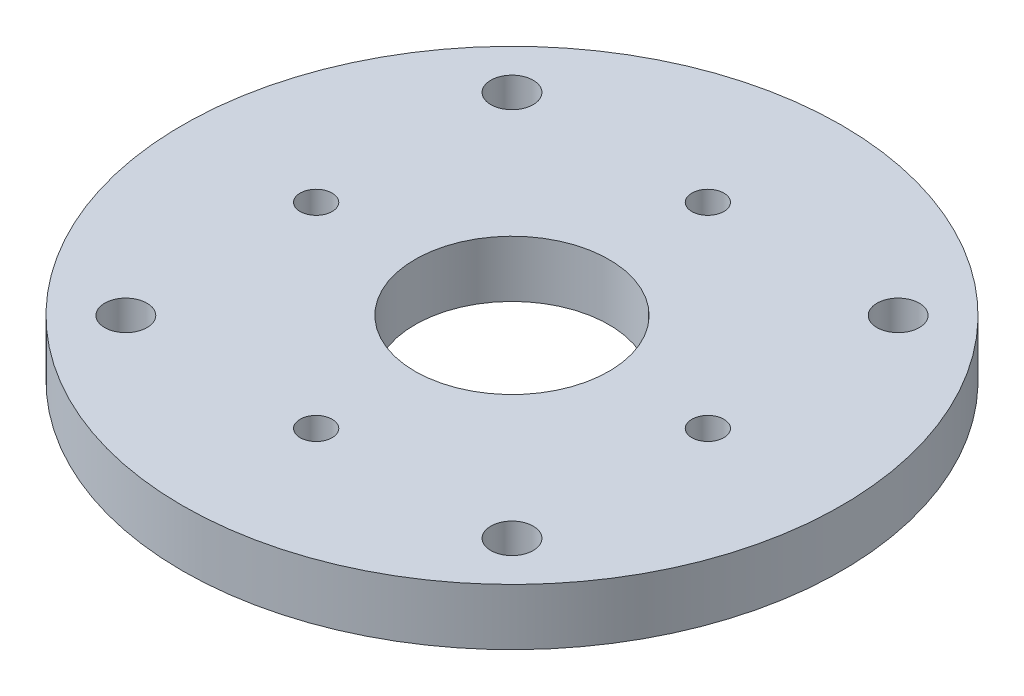
from build123d import *

# Parameters (mm, degrees)
SKETCH1_R           = 35
SKETCH1_R_2         = 10.3
BOSS_EXTRUDE1_DEPTH = 6
SKETCH3_R           = 1.7
CUT_EXTRUDE1_DEPTH  = 50.859803449
SKETCH5_R           = 2.25
CUT_EXTRUDE2_DEPTH  = 50.859803449


with BuildPart() as part:
    # Sketch1 → Boss-Extrude1 (new body)
    with BuildSketch(Plane(origin=(0, 0, 0), x_dir=(1, 0, 0), z_dir=(0, 1, 0))):
        with Locations(Location((0, 0, 0), (0, 0, 270))):
            Circle(SKETCH1_R)
        with Locations(Location((0, 0, 0), (0, 0, 270))):
            Circle(SKETCH1_R_2, mode=Mode.SUBTRACT)
    extrude(amount=BOSS_EXTRUDE1_DEPTH)

    # Sketch3 → Cut-Extrude1 (cut, through all)
    with BuildSketch(Plane(origin=(0, 6, 0), x_dir=(1, 0, 0), z_dir=(0, 1, 0))):
        with Locations(Location((-20.8, 0, 0), (0, 0, 270))):
            Circle(SKETCH3_R)
        with Locations(Location((0, 20.8, 0), (0, 0, 270))):
            Circle(SKETCH3_R)
        with Locations(Location((20.8, 0, 0), (0, 0, 270))):
            Circle(SKETCH3_R)
        with Locations(Location((0, -20.8, 0), (0, 0, 270))):
            Circle(SKETCH3_R)
    extrude(amount=-CUT_EXTRUDE1_DEPTH, mode=Mode.SUBTRACT)

    # Sketch5 → Cut-Extrude2 (cut, through all)
    with BuildSketch(Plane(origin=(0, 6, 0), x_dir=(1, 0, 0), z_dir=(0, 1, 0))):
        with Locations(Location((-20.506096654, 20.506096654, 0), (0, 0, 270))):
            Circle(SKETCH5_R)
        with Locations(Location((-20.506096654, -20.506096654, 0), (0, 0, 270))):
            Circle(SKETCH5_R)
        with Locations(Location((20.506096654, 20.506096654, 0), (0, 0, 270))):
            Circle(SKETCH5_R)
        with Locations(Location((20.506096654, -20.506096654, 0), (0, 0, 270))):
            Circle(SKETCH5_R)
    extrude(amount=-CUT_EXTRUDE2_DEPTH, mode=Mode.SUBTRACT)


solid = part.part
